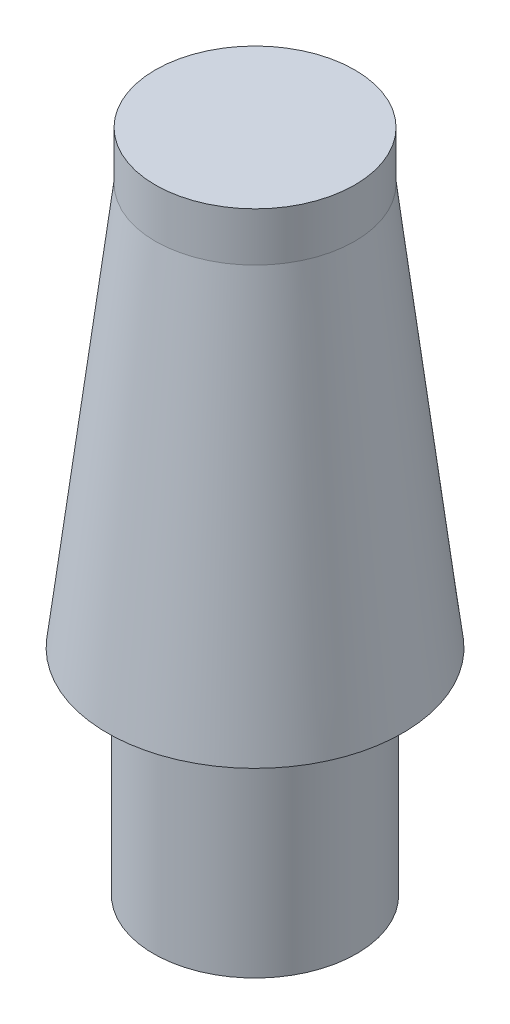
from build123d import *

# Parameters (mm, degrees)
SKETCH3_R          = 30.48
CUT_EXTRUDE1_DEPTH = 73.66


with BuildPart() as part:
    # Sketch1 → Revolve1 (revolve)
    with BuildSketch(Plane.XY, mode=Mode.PRIVATE) as revolve1_sk:
        Polygon((34.925, 0), (34.925, 73.66), (50.8, 73.66), (34.29, 211.836), (34.29, 228.6), (0, 228.6), (0, 0), align=None)
    revolve(revolve1_sk.sketch.rotate(Axis((0, 0, 0), (0, 1, 0)), 90), axis=Axis((0, 0, 0), (0, 1, 0)))

    # Sketch3 → Cut-Extrude1 (cut)
    with BuildSketch(Plane.XZ):
        with Locations(Location((0, 0, 0), (0, 0, 270))):
            Circle(SKETCH3_R)
    extrude(amount=-CUT_EXTRUDE1_DEPTH, mode=Mode.SUBTRACT)


solid = part.part
